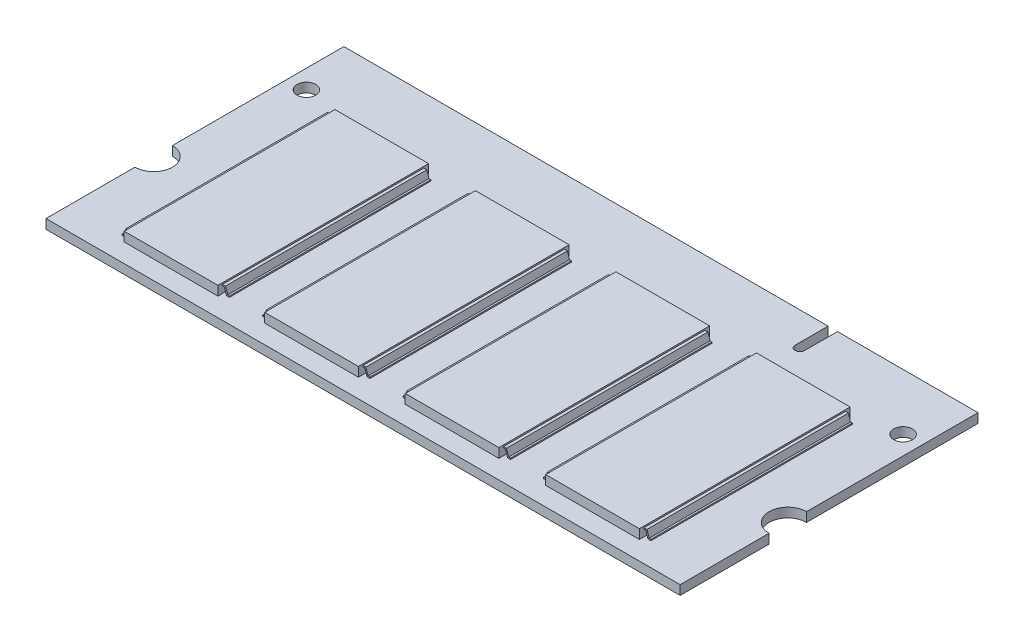
from build123d import *

# Parameters (mm, degrees)
CROQUIS1_R       = 1
EXTRUIR1_DEPTH   = 1
CROQUIS2_W       = 10
CROQUIS2_H       = 22.5
EXTRUIR2_DEPTH   = 1
EXTRUIR2_2_DEPTH = 1
EXTRUIR2_3_DEPTH = 1
EXTRUIR2_4_DEPTH = 1
EXTRUIR3_DEPTH   = 21.5
EXTRUIR3_2_DEPTH = 21.5
EXTRUIR3_3_DEPTH = 21.5
EXTRUIR3_4_DEPTH = 21.5
EXTRUIR3_5_DEPTH = 21.5
EXTRUIR3_6_DEPTH = 21.5
EXTRUIR3_7_DEPTH = 21.5
EXTRUIR3_8_DEPTH = 21.5


with BuildPart() as part:
    # Croquis1 → Extruir1 (new body)
    with BuildSketch(Plane(origin=(0, 0, 0), x_dir=(1, 0, 0), z_dir=(0, 1, 0))):
        with BuildLine():
            Line((33.85, 9.5), (33.85, 0))
            Line((33.85, 0), (-33.85, 0))
            Line((-33.85, 0), (-33.85, 9.5))
            ThreePointArc((-33.85, 9.5), (-31.85, 11.5), (-33.85, 13.5))
            Line((-33.85, 13.5), (-33.85, 31.8))
            Line((-33.85, 31.8), (17.85, 31.8))
            Line((17.85, 31.8), (17.85, 28.25))
            ThreePointArc((17.85, 28.25), (17.981801948, 27.931801948), (18.3, 27.8))
            Line((18.3, 27.8), (18.4, 27.8))
            ThreePointArc((18.4, 27.8), (18.718198052, 27.931801948), (18.85, 28.25))
            Line((18.85, 28.25), (18.85, 31.8))
            Line((18.85, 31.8), (33.85, 31.8))
            Line((33.85, 31.8), (33.85, 13.5))
            ThreePointArc((33.85, 13.5), (31.85, 11.5), (33.85, 9.5))
        make_face()
        with Locations(Location((31.85, 25.8, 0), (0, 0, 270))):
            Circle(CROQUIS1_R, mode=Mode.SUBTRACT)
        with Locations(Location((-31.85, 25.8, 0), (0, 0, 90))):
            Circle(CROQUIS1_R, mode=Mode.SUBTRACT)
    extrude(amount=EXTRUIR1_DEPTH)


with BuildPart() as body_2:
    # Croquis2 → Extruir2 (new body)
    with BuildSketch(Plane(origin=(0, 1, 0), x_dir=(-1, 0, 0), z_dir=(0, 1, 0))):
        with Locations((7.5, -13.25)):
            Rectangle(CROQUIS2_W, CROQUIS2_H)
    extrude(amount=EXTRUIR2_DEPTH)


with BuildPart() as body_3:
    # Croquis2 → Extruir2 2 (new body)
    with BuildSketch(Plane(origin=(0, 1, 0), x_dir=(-1, 0, 0), z_dir=(0, 1, 0))):
        with Locations((22.5, -13.25)):
            Rectangle(CROQUIS2_W, CROQUIS2_H)
    extrude(amount=EXTRUIR2_2_DEPTH)


with BuildPart() as body_4:
    # Croquis2 → Extruir2 3 (new body)
    with BuildSketch(Plane(origin=(0, 1, 0), x_dir=(-1, 0, 0), z_dir=(0, 1, 0))):
        with Locations((-22.5, -13.25)):
            Rectangle(CROQUIS2_W, CROQUIS2_H)
    extrude(amount=EXTRUIR2_3_DEPTH)


with BuildPart() as body_5:
    # Croquis2 → Extruir2 4 (new body)
    with BuildSketch(Plane(origin=(0, 1, 0), x_dir=(-1, 0, 0), z_dir=(0, 1, 0))):
        with Locations((-7.5, -13.25)):
            Rectangle(CROQUIS2_W, CROQUIS2_H)
    extrude(amount=EXTRUIR2_4_DEPTH)


with BuildPart() as body_6:
    # Croquis3 → Extruir3 (new body)
    with BuildSketch(Plane(origin=(0, 0, -24), x_dir=(-1, 0, 0), z_dir=(0, 0, -1))):
        Polygon((27.5, 1.838454184), (27.80957835, 1.838454184), (28.043008569, 1.138163525), (28.232670623, 1.138163525), (28.232670623, 1), (27.926293459, 1), (27.692264471, 1.702086966), (27.5, 1.702086966), align=None)
    extrude(amount=-EXTRUIR3_DEPTH)


with BuildPart() as body_7:
    # Croquis3 → Extruir3 2 (new body)
    with BuildSketch(Plane(origin=(0, 0, -24), x_dir=(-1, 0, 0), z_dir=(0, 0, -1))):
        Polygon((17.5, 1.702086966), (17.5, 1.838454184), (17.19042165, 1.838454184), (16.956991431, 1.138163525), (16.767329377, 1.138163525), (16.767329377, 1), (17.073706541, 1), (17.307735529, 1.702086966), align=None)
    extrude(amount=-EXTRUIR3_2_DEPTH)


with BuildPart() as body_8:
    # Croquis3 → Extruir3 3 (new body)
    with BuildSketch(Plane(origin=(0, 0, -24), x_dir=(-1, 0, 0), z_dir=(0, 0, -1))):
        Polygon((1.767329377, 1), (2.073706541, 1), (2.307735529, 1.702086966), (2.5, 1.702086966), (2.5, 1.838454184), (2.19042165, 1.838454184), (1.956991431, 1.138163525), (1.767329377, 1.138163525), align=None)
    extrude(amount=-EXTRUIR3_3_DEPTH)


with BuildPart() as body_9:
    # Croquis3 → Extruir3 4 (new body)
    with BuildSketch(Plane(origin=(0, 0, -24), x_dir=(-1, 0, 0), z_dir=(0, 0, -1))):
        Polygon((12.80957835, 1.838454184), (13.043008569, 1.138163525), (13.232670623, 1.138163525), (13.232670623, 1), (12.926293459, 1), (12.692264471, 1.702086966), (12.5, 1.702086966), (12.5, 1.838454184), align=None)
    extrude(amount=-EXTRUIR3_4_DEPTH)


with BuildPart() as body_10:
    # Croquis3 → Extruir3 5 (new body)
    with BuildSketch(Plane(origin=(0, 0, -24), x_dir=(-1, 0, 0), z_dir=(0, 0, -1))):
        Polygon((-13.232670623, 1), (-12.926293459, 1), (-12.692264471, 1.702086966), (-12.5, 1.702086966), (-12.5, 1.838454184), (-12.80957835, 1.838454184), (-13.043008569, 1.138163525), (-13.232670623, 1.138163525), align=None)
    extrude(amount=-EXTRUIR3_5_DEPTH)


with BuildPart() as body_11:
    # Croquis3 → Extruir3 6 (new body)
    with BuildSketch(Plane(origin=(0, 0, -24), x_dir=(-1, 0, 0), z_dir=(0, 0, -1))):
        Polygon((-2.19042165, 1.838454184), (-1.956991431, 1.138163525), (-1.767329377, 1.138163525), (-1.767329377, 1), (-2.073706541, 1), (-2.307735529, 1.702086966), (-2.5, 1.702086966), (-2.5, 1.838454184), align=None)
    extrude(amount=-EXTRUIR3_6_DEPTH)


with BuildPart() as body_12:
    # Croquis3 → Extruir3 7 (new body)
    with BuildSketch(Plane(origin=(0, 0, -24), x_dir=(-1, 0, 0), z_dir=(0, 0, -1))):
        Polygon((-28.232670623, 1), (-27.926293459, 1), (-27.692264471, 1.702086966), (-27.5, 1.702086966), (-27.5, 1.838454184), (-27.80957835, 1.838454184), (-28.043008569, 1.138163525), (-28.232670623, 1.138163525), align=None)
    extrude(amount=-EXTRUIR3_7_DEPTH)


with BuildPart() as body_13:
    # Croquis3 → Extruir3 8 (new body)
    with BuildSketch(Plane(origin=(0, 0, -24), x_dir=(-1, 0, 0), z_dir=(0, 0, -1))):
        Polygon((-17.19042165, 1.838454184), (-16.956991431, 1.138163525), (-16.767329377, 1.138163525), (-16.767329377, 1), (-17.073706541, 1), (-17.307735529, 1.702086966), (-17.5, 1.702086966), (-17.5, 1.838454184), align=None)
    extrude(amount=-EXTRUIR3_8_DEPTH)


with BuildPart() as body_14:
    # Simetría2: mirrored copy
    add(body_4.part.mirror(Plane.ZX.offset(0.5)))


with BuildPart() as body_15:
    # Simetr_a2 2: mirrored copy
    add(body_5.part.mirror(Plane.ZX.offset(0.5)))


with BuildPart() as body_16:
    # Simetr_a2 3: mirrored copy
    add(body_2.part.mirror(Plane.ZX.offset(0.5)))


with BuildPart() as body_17:
    # Simetr_a2 4: mirrored copy
    add(body_3.part.mirror(Plane.ZX.offset(0.5)))


with BuildPart() as body_18:
    # Simetr_a2 5: mirrored copy
    add(body_9.part.mirror(Plane.ZX.offset(0.5)))


with BuildPart() as body_19:
    # Simetr_a2 6: mirrored copy
    add(body_6.part.mirror(Plane.ZX.offset(0.5)))


with BuildPart() as body_20:
    # Simetr_a2 7: mirrored copy
    add(body_11.part.mirror(Plane.ZX.offset(0.5)))


with BuildPart() as body_21:
    # Simetr_a2 8: mirrored copy
    add(body_13.part.mirror(Plane.ZX.offset(0.5)))


with BuildPart() as body_22:
    # Simetr_a2 9: mirrored copy
    add(body_12.part.mirror(Plane.ZX.offset(0.5)))


with BuildPart() as body_23:
    # Simetr_a2 10: mirrored copy
    add(body_10.part.mirror(Plane.ZX.offset(0.5)))


with BuildPart() as body_24:
    # Simetr_a2 11: mirrored copy
    add(body_8.part.mirror(Plane.ZX.offset(0.5)))


with BuildPart() as body_25:
    # Simetr_a2 12: mirrored copy
    add(body_7.part.mirror(Plane.ZX.offset(0.5)))


solid = Compound([part.part, body_2.part, body_3.part, body_4.part, body_5.part, body_6.part, body_7.part, body_8.part, body_9.part, body_10.part, body_11.part, body_12.part, body_13.part, body_14.part, body_15.part, body_16.part, body_17.part, body_18.part, body_19.part, body_20.part, body_21.part, body_22.part, body_23.part, body_24.part, body_25.part])
